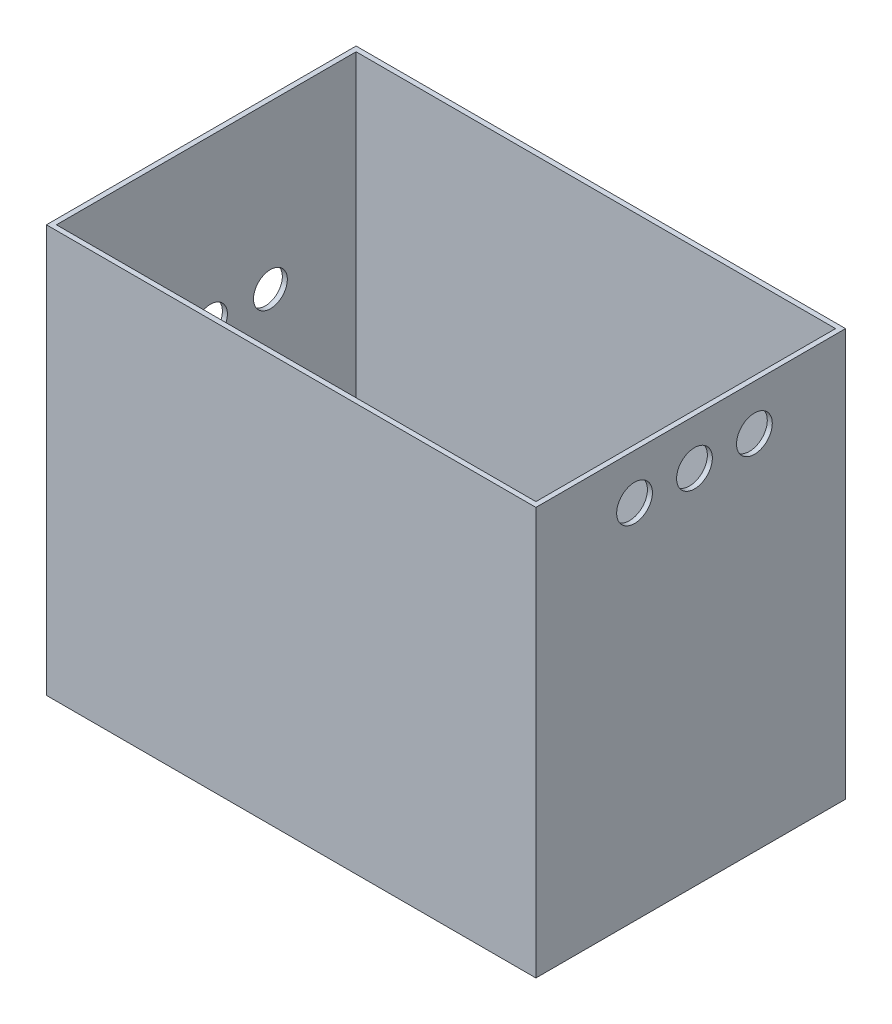
from build123d import *

# Parameters (mm, degrees)
SKETCH1_W                = 152.4
SKETCH1_H                = 190.5
BOSS_EXTRUDE1_DEPTH      = 5.08
BOSS_EXTRUDE2_DEPTH      = 254
BOSS_EXTRUDE2_DEPTH_BACK = 5.08
SKETCH2_W                = 311.15
SKETCH2_H                = 196.85
SKETCH3_W                = 304.8
SKETCH3_H                = 190.5
CUT_EXTRUDE1_DEPTH       = 252.73
SKETCH4_R                = 10.75942509
CUT_EXTRUDE2_DEPTH       = 252.73
SKETCH5_R                = 11.36861001
CUT_EXTRUDE3_DEPTH       = 252.73


with BuildPart() as part:
    # Sketch1 → Boss-Extrude1 (new body)
    with BuildSketch(Plane(origin=(0, 0, 0), x_dir=(1, 0, 0), z_dir=(0, 1, 0))):
        with Locations((-76.2, 0)):
            Rectangle(SKETCH1_W, SKETCH1_H)
    extrude(amount=BOSS_EXTRUDE1_DEPTH)

    # Sketch2 → Boss-Extrude2 (add, two sides: drawn at the far end of the back side and taken through both)
    with BuildSketch(Plane(origin=(0, 5.08, 0), x_dir=(1, 0, 0), z_dir=(0, 1, 0)).offset(-BOSS_EXTRUDE2_DEPTH_BACK)):
        Rectangle(SKETCH2_W, SKETCH2_H)
    extrude(amount=BOSS_EXTRUDE2_DEPTH + BOSS_EXTRUDE2_DEPTH_BACK)

    # Sketch3 → Cut-Extrude1 (cut)
    with BuildSketch(Plane(origin=(0, 259.08, 0), x_dir=(1, 0, 0), z_dir=(0, 1, 0))):
        Rectangle(SKETCH3_W, SKETCH3_H)
    extrude(amount=-CUT_EXTRUDE1_DEPTH, mode=Mode.SUBTRACT)

    # Sketch4 → Cut-Extrude2 (cut)
    with BuildSketch(Plane.ZY.offset(155.575)):
        with Locations((-40.782647245, 155.631127926)):
            Circle(SKETCH4_R)
        with Locations((-2.682647245, 155.631127926)):
            Circle(SKETCH4_R)
        with Locations((35.417352755, 155.631127926)):
            Circle(SKETCH4_R)
    extrude(amount=-CUT_EXTRUDE2_DEPTH, mode=Mode.SUBTRACT)

    # Sketch5 → Cut-Extrude3 (cut)
    with BuildSketch(Plane(origin=(155.575, 0, 0), x_dir=(0, 0, -1), z_dir=(1, 0, 0))):
        with Locations((-35.725024922, 230.210156067)):
            Circle(SKETCH5_R)
        with Locations((2.374975078, 230.210156067)):
            Circle(SKETCH5_R)
        with Locations((40.474975078, 230.210156067)):
            Circle(SKETCH5_R)
    extrude(amount=-CUT_EXTRUDE3_DEPTH, mode=Mode.SUBTRACT)


solid = part.part
